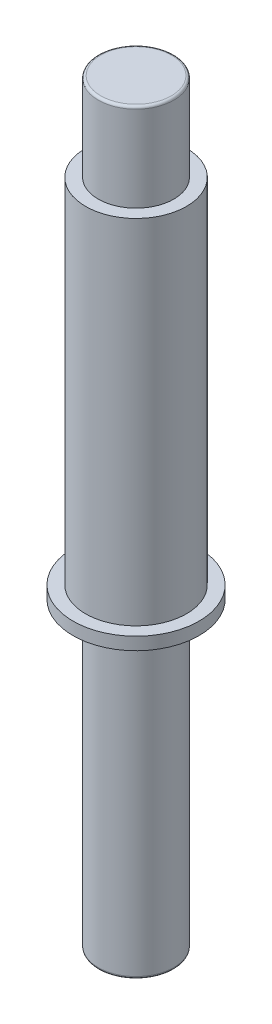
from build123d import *

# Parameters (mm, degrees)
SKETCH_1_R      = 1.5
EXTRUDE_1_DEPTH = 30
SKETCH_2_R      = 2
SKETCH_2_R_2    = 1.5
EXTRUDE_2_DEPTH = 14.5
FILLET_1_R      = 0.1
SKETCH_3_R      = 2.5
SKETCH_3_R_2    = 2
EXTRUDE_3_DEPTH = 0.5


with BuildPart() as part:
    # 草图1 → 凸台-拉伸1 (new body)
    with BuildSketch(Plane(origin=(0, 0, 0), x_dir=(1, 0, 0), z_dir=(0, 1, 0))):
        with Locations(Location((0, 0, 0), (0, 0, 270))):
            Circle(SKETCH_1_R)
    extrude(amount=EXTRUDE_1_DEPTH)

    # 草图2 → 凸台-拉伸2 (add)
    with BuildSketch(Plane(origin=(0, 12, 0), x_dir=(1, 0, 0), z_dir=(0, 1, 0))):
        with Locations(Location((0, 0, 0), (0, 0, 90))):
            Circle(SKETCH_2_R)
        with Locations(Location((0, 0, 0), (0, 0, 270))):
            Circle(SKETCH_2_R_2, mode=Mode.SUBTRACT)
    extrude(amount=EXTRUDE_2_DEPTH)

    # 圆角1
    fillet_1_edges = [part.edges().sort_by_distance(p)[0] for p in [
        (0, 0, -1.5),
        (0, 30, -1.5),
    ]]
    fillet(fillet_1_edges, radius=FILLET_1_R)

    # 草图3 → 凸台-拉伸3 (add)
    with BuildSketch(Plane(origin=(0, 12, 0), x_dir=(-1, 0, 0), z_dir=(0, -1, 0))):
        with Locations(Location((0, 0, 0), (0, 0, 90))):
            Circle(SKETCH_3_R)
        with Locations(Location((0, 0, 0), (0, 0, 90))):
            Circle(SKETCH_3_R_2, mode=Mode.SUBTRACT)
    extrude(amount=-EXTRUDE_3_DEPTH)


solid = part.part
